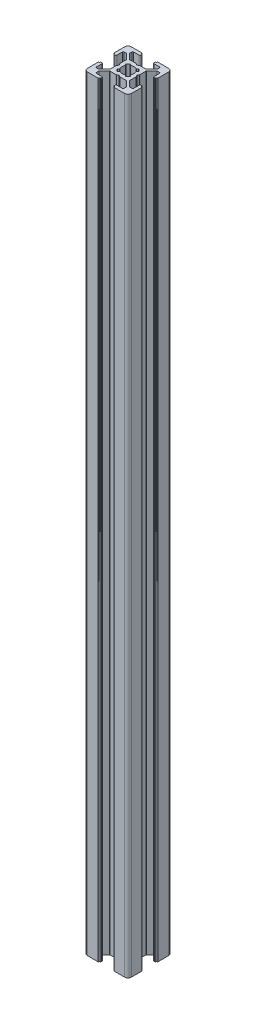
from build123d import *

# Parameters (mm, degrees)
BOSS_EXTRUDE1_DEPTH = 175


with BuildPart() as part:
    # Sketch2 → Boss-Extrude1 (new, symmetric)
    with BuildSketch(Plane(origin=(0, 0, 0), x_dir=(1, 0, 0), z_dir=(0, 1, 0))):
        with BuildLine():
            Line((-10, 3.75), (-10, 8.5))
            ThreePointArc((-10, 8.5), (-9.560660172, 9.560660172), (-8.5, 10))
            Line((-8.5, 10), (-3.75, 10))
            ThreePointArc((-3.75, 10), (-3.608578644, 9.941421356), (-3.55, 9.8))
            Line((-3.55, 9.8), (-3.55, 9.7))
            ThreePointArc((-3.55, 9.7), (-3.491421356, 9.558578644), (-3.35, 9.5))
            Line((-3.35, 9.5), (-3.2, 9.5))
            ThreePointArc((-3.2, 9.5), (-3.058578644, 9.441421356), (-3, 9.3))
            Line((-3, 9.3), (-3, 8.9))
            ThreePointArc((-3, 8.9), (-3.117157288, 8.617157288), (-3.4, 8.5))
            Line((-3.4, 8.5), (-5.9, 8.5))
            ThreePointArc((-5.9, 8.5), (-6.182842712, 8.382842712), (-6.3, 8.1))
            Line((-6.3, 8.1), (-6.3, 7.172792206))
            ThreePointArc((-6.3, 7.172792206), (-6.269551813, 7.019718833), (-6.182842712, 6.889949494))
            Line((-6.182842712, 6.889949494), (-3.910050506, 4.617157288))
            ThreePointArc((-3.910050506, 4.617157288), (-3.780281167, 4.530448187), (-3.627207794, 4.5))
            Line((-3.627207794, 4.5), (-0.919615242, 4.5))
            ThreePointArc((-0.919615242, 4.5), (-0.867851433, 4.493185165), (-0.819615242, 4.473205081))
            Line((-0.819615242, 4.473205081), (-0.1, 4.057735027))
            ThreePointArc((-0.1, 4.057735027), (0, 4.030940108), (0.1, 4.057735027))
            Line((0.1, 4.057735027), (0.819615242, 4.473205081))
            ThreePointArc((0.819615242, 4.473205081), (0.867851433, 4.493185165), (0.919615242, 4.5))
            Line((0.919615242, 4.5), (3.627207794, 4.5))
            ThreePointArc((3.627207794, 4.5), (3.780281167, 4.530448187), (3.910050506, 4.617157288))
            Line((3.910050506, 4.617157288), (6.182842712, 6.889949494))
            ThreePointArc((6.182842712, 6.889949494), (6.269551813, 7.019718833), (6.3, 7.172792206))
            Line((6.3, 7.172792206), (6.3, 8.1))
            ThreePointArc((6.3, 8.1), (6.182842712, 8.382842712), (5.9, 8.5))
            Line((5.9, 8.5), (3.4, 8.5))
            ThreePointArc((3.4, 8.5), (3.117157288, 8.617157288), (3, 8.9))
            Line((3, 8.9), (3, 9.3))
            ThreePointArc((3, 9.3), (3.058578644, 9.441421356), (3.2, 9.5))
            Line((3.2, 9.5), (3.35, 9.5))
            ThreePointArc((3.35, 9.5), (3.491421356, 9.558578644), (3.55, 9.7))
            Line((3.55, 9.7), (3.55, 9.8))
            ThreePointArc((3.55, 9.8), (3.608578644, 9.941421356), (3.75, 10))
            Line((3.75, 10), (8.5, 10))
            ThreePointArc((8.5, 10), (9.560660172, 9.560660172), (10, 8.5))
            Line((10, 8.5), (10, 3.75))
            ThreePointArc((10, 3.75), (9.941421356, 3.608578644), (9.8, 3.55))
            Line((9.8, 3.55), (9.7, 3.55))
            ThreePointArc((9.7, 3.55), (9.558578644, 3.491421356), (9.5, 3.35))
            Line((9.5, 3.35), (9.5, 3.2))
            ThreePointArc((9.5, 3.2), (9.441421356, 3.058578644), (9.3, 3))
            Line((9.3, 3), (8.9, 3))
            ThreePointArc((8.9, 3), (8.617157288, 3.117157288), (8.5, 3.4))
            Line((8.5, 3.4), (8.5, 5.9))
            ThreePointArc((8.5, 5.9), (8.382842712, 6.182842712), (8.1, 6.3))
            Line((8.1, 6.3), (7.172792206, 6.3))
            ThreePointArc((7.172792206, 6.3), (7.019718833, 6.269551813), (6.889949494, 6.182842712))
            Line((6.889949494, 6.182842712), (4.617157288, 3.910050506))
            ThreePointArc((4.617157288, 3.910050506), (4.530448187, 3.780281167), (4.5, 3.627207794))
            Line((4.5, 3.627207794), (4.5, 0.919615242))
            ThreePointArc((4.5, 0.919615242), (4.493185165, 0.867851433), (4.473205081, 0.819615242))
            Line((4.473205081, 0.819615242), (4.057735027, 0.1))
            ThreePointArc((4.057735027, 0.1), (4.030940108, 0), (4.057735027, -0.1))
            Line((4.057735027, -0.1), (4.473205081, -0.819615242))
            ThreePointArc((4.473205081, -0.819615242), (4.493185165, -0.867851433), (4.5, -0.919615242))
            Line((4.5, -0.919615242), (4.5, -3.627207794))
            ThreePointArc((4.5, -3.627207794), (4.530448187, -3.780281167), (4.617157288, -3.910050506))
            Line((4.617157288, -3.910050506), (6.889949494, -6.182842712))
            ThreePointArc((6.889949494, -6.182842712), (7.019718833, -6.269551813), (7.172792206, -6.3))
            Line((7.172792206, -6.3), (8.1, -6.3))
            ThreePointArc((8.1, -6.3), (8.382842712, -6.182842712), (8.5, -5.9))
            Line((8.5, -5.9), (8.5, -3.4))
            ThreePointArc((8.5, -3.4), (8.617157288, -3.117157288), (8.9, -3))
            Line((8.9, -3), (9.3, -3))
            ThreePointArc((9.3, -3), (9.441421356, -3.058578644), (9.5, -3.2))
            Line((9.5, -3.2), (9.5, -3.35))
            ThreePointArc((9.5, -3.35), (9.558578644, -3.491421356), (9.7, -3.55))
            Line((9.7, -3.55), (9.8, -3.55))
            ThreePointArc((9.8, -3.55), (9.941421356, -3.608578644), (10, -3.75))
            Line((10, -3.75), (10, -8.5))
            ThreePointArc((10, -8.5), (9.560660172, -9.560660172), (8.5, -10))
            Line((8.5, -10), (3.75, -10))
            ThreePointArc((3.75, -10), (3.608578644, -9.941421356), (3.55, -9.8))
            Line((3.55, -9.8), (3.55, -9.7))
            ThreePointArc((3.55, -9.7), (3.491421356, -9.558578644), (3.35, -9.5))
            Line((3.35, -9.5), (3.2, -9.5))
            ThreePointArc((3.2, -9.5), (3.058578644, -9.441421356), (3, -9.3))
            Line((3, -9.3), (3, -8.9))
            ThreePointArc((3, -8.9), (3.117157288, -8.617157288), (3.4, -8.5))
            Line((3.4, -8.5), (5.9, -8.5))
            ThreePointArc((5.9, -8.5), (6.182842712, -8.382842712), (6.3, -8.1))
            Line((6.3, -8.1), (6.3, -7.172792206))
            ThreePointArc((6.3, -7.172792206), (6.269551813, -7.019718833), (6.182842712, -6.889949494))
            Line((6.182842712, -6.889949494), (3.910050506, -4.617157288))
            ThreePointArc((3.910050506, -4.617157288), (3.780281167, -4.530448187), (3.627207794, -4.5))
            Line((3.627207794, -4.5), (0.919615242, -4.5))
            ThreePointArc((0.919615242, -4.5), (0.867851433, -4.493185165), (0.819615242, -4.473205081))
            Line((0.819615242, -4.473205081), (0.1, -4.057735027))
            ThreePointArc((0.1, -4.057735027), (0, -4.030940108), (-0.1, -4.057735027))
            Line((-0.1, -4.057735027), (-0.819615242, -4.473205081))
            ThreePointArc((-0.819615242, -4.473205081), (-0.867851433, -4.493185165), (-0.919615242, -4.5))
            Line((-0.919615242, -4.5), (-3.627207794, -4.5))
            ThreePointArc((-3.627207794, -4.5), (-3.780281167, -4.530448187), (-3.910050506, -4.617157288))
            Line((-3.910050506, -4.617157288), (-6.182842712, -6.889949494))
            ThreePointArc((-6.182842712, -6.889949494), (-6.269551813, -7.019718833), (-6.3, -7.172792206))
            Line((-6.3, -7.172792206), (-6.3, -8.1))
            ThreePointArc((-6.3, -8.1), (-6.182842712, -8.382842712), (-5.9, -8.5))
            Line((-5.9, -8.5), (-3.4, -8.5))
            ThreePointArc((-3.4, -8.5), (-3.117157288, -8.617157288), (-3, -8.9))
            Line((-3, -8.9), (-3, -9.3))
            ThreePointArc((-3, -9.3), (-3.058578644, -9.441421356), (-3.2, -9.5))
            Line((-3.2, -9.5), (-3.35, -9.5))
            ThreePointArc((-3.35, -9.5), (-3.491421356, -9.558578644), (-3.55, -9.7))
            Line((-3.55, -9.7), (-3.55, -9.8))
            ThreePointArc((-3.55, -9.8), (-3.608578644, -9.941421356), (-3.75, -10))
            Line((-3.75, -10), (-8.5, -10))
            ThreePointArc((-8.5, -10), (-9.560660172, -9.560660172), (-10, -8.5))
            Line((-10, -8.5), (-10, -3.75))
            ThreePointArc((-10, -3.75), (-9.941421356, -3.608578644), (-9.8, -3.55))
            Line((-9.8, -3.55), (-9.7, -3.55))
            ThreePointArc((-9.7, -3.55), (-9.558578644, -3.491421356), (-9.5, -3.35))
            Line((-9.5, -3.35), (-9.5, -3.2))
            ThreePointArc((-9.5, -3.2), (-9.441421356, -3.058578644), (-9.3, -3))
            Line((-9.3, -3), (-8.9, -3))
            ThreePointArc((-8.9, -3), (-8.617157288, -3.117157288), (-8.5, -3.4))
            Line((-8.5, -3.4), (-8.5, -5.9))
            ThreePointArc((-8.5, -5.9), (-8.382842712, -6.182842712), (-8.1, -6.3))
            Line((-8.1, -6.3), (-7.172792206, -6.3))
            ThreePointArc((-7.172792206, -6.3), (-7.019718833, -6.269551813), (-6.889949494, -6.182842712))
            Line((-6.889949494, -6.182842712), (-4.617157288, -3.910050506))
            ThreePointArc((-4.617157288, -3.910050506), (-4.530448187, -3.780281167), (-4.5, -3.627207794))
            Line((-4.5, -3.627207794), (-4.5, -0.919615242))
            ThreePointArc((-4.5, -0.919615242), (-4.493185165, -0.867851433), (-4.473205081, -0.819615242))
            Line((-4.473205081, -0.819615242), (-4.057735027, -0.1))
            ThreePointArc((-4.057735027, -0.1), (-4.030940108, 0), (-4.057735027, 0.1))
            Line((-4.057735027, 0.1), (-4.473205081, 0.819615242))
            ThreePointArc((-4.473205081, 0.819615242), (-4.493185165, 0.867851433), (-4.5, 0.919615242))
            Line((-4.5, 0.919615242), (-4.5, 3.627207794))
            ThreePointArc((-4.5, 3.627207794), (-4.530448187, 3.780281167), (-4.617157288, 3.910050506))
            Line((-4.617157288, 3.910050506), (-6.889949494, 6.182842712))
            ThreePointArc((-6.889949494, 6.182842712), (-7.019718833, 6.269551813), (-7.172792206, 6.3))
            Line((-7.172792206, 6.3), (-8.1, 6.3))
            ThreePointArc((-8.1, 6.3), (-8.382842712, 6.182842712), (-8.5, 5.9))
            Line((-8.5, 5.9), (-8.5, 3.4))
            ThreePointArc((-8.5, 3.4), (-8.617157288, 3.117157288), (-8.9, 3))
            Line((-8.9, 3), (-9.3, 3))
            ThreePointArc((-9.3, 3), (-9.441421356, 3.058578644), (-9.5, 3.2))
            Line((-9.5, 3.2), (-9.5, 3.35))
            ThreePointArc((-9.5, 3.35), (-9.558578644, 3.491421356), (-9.7, 3.55))
            Line((-9.7, 3.55), (-9.8, 3.55))
            ThreePointArc((-9.8, 3.55), (-9.941421356, 3.608578644), (-10, 3.75))
        make_face()
        with BuildLine():
            Line((-2.479688955, 1.419028783), (-2.896761999, 1.836101827))
            ThreePointArc((-2.896761999, 1.836101827), (-2.940106295, 1.928880314), (-2.913814922, 2.02785172))
            ThreePointArc((-2.913814922, 2.02785172), (-2.510229073, 2.510229073), (-2.02785172, 2.913814922))
            ThreePointArc((-2.02785172, 2.913814922), (-1.928880314, 2.940106295), (-1.836101827, 2.896761999))
            Line((-1.836101827, 2.896761999), (-1.419028783, 2.479688955))
            ThreePointArc((-1.419028783, 2.479688955), (-1.336531377, 2.437618141), (-1.245050899, 2.452009025))
            ThreePointArc((-1.245050899, 2.452009025), (0, 2.75), (1.245050899, 2.452009025))
            ThreePointArc((1.245050899, 2.452009025), (1.336531377, 2.437618141), (1.419028783, 2.479688955))
            Line((1.419028783, 2.479688955), (1.836101827, 2.896761999))
            ThreePointArc((1.836101827, 2.896761999), (1.928880314, 2.940106295), (2.02785172, 2.913814922))
            ThreePointArc((2.02785172, 2.913814922), (2.510229073, 2.510229073), (2.913814922, 2.02785172))
            ThreePointArc((2.913814922, 2.02785172), (2.940106295, 1.928880314), (2.896761999, 1.836101827))
            Line((2.896761999, 1.836101827), (2.479688955, 1.419028783))
            ThreePointArc((2.479688955, 1.419028783), (2.437618141, 1.336531377), (2.452009025, 1.245050899))
            ThreePointArc((2.452009025, 1.245050899), (2.75, 0), (2.452009025, -1.245050899))
            ThreePointArc((2.452009025, -1.245050899), (2.437618141, -1.336531377), (2.479688955, -1.419028783))
            Line((2.479688955, -1.419028783), (2.896761999, -1.836101827))
            ThreePointArc((2.896761999, -1.836101827), (2.940106295, -1.928880314), (2.913814922, -2.02785172))
            ThreePointArc((2.913814922, -2.02785172), (2.510229073, -2.510229073), (2.02785172, -2.913814922))
            ThreePointArc((2.02785172, -2.913814922), (1.928880314, -2.940106295), (1.836101827, -2.896761999))
            Line((1.836101827, -2.896761999), (1.419028783, -2.479688955))
            ThreePointArc((1.419028783, -2.479688955), (1.336531377, -2.437618141), (1.245050899, -2.452009025))
            ThreePointArc((1.245050899, -2.452009025), (0, -2.75), (-1.245050899, -2.452009025))
            ThreePointArc((-1.245050899, -2.452009025), (-1.336531377, -2.437618141), (-1.419028783, -2.479688955))
            Line((-1.419028783, -2.479688955), (-1.836101827, -2.896761999))
            ThreePointArc((-1.836101827, -2.896761999), (-1.928880314, -2.940106295), (-2.02785172, -2.913814922))
            ThreePointArc((-2.02785172, -2.913814922), (-2.510229073, -2.510229073), (-2.913814922, -2.02785172))
            ThreePointArc((-2.913814922, -2.02785172), (-2.940106295, -1.928880314), (-2.896761999, -1.836101827))
            Line((-2.896761999, -1.836101827), (-2.479688955, -1.419028783))
            ThreePointArc((-2.479688955, -1.419028783), (-2.437618141, -1.336531377), (-2.452009025, -1.245050899))
            ThreePointArc((-2.452009025, -1.245050899), (-2.75, 0), (-2.452009025, 1.245050899))
            ThreePointArc((-2.452009025, 1.245050899), (-2.437618141, 1.336531377), (-2.479688955, 1.419028783))
        make_face(mode=Mode.SUBTRACT)
    extrude(amount=BOSS_EXTRUDE1_DEPTH, both=True)


solid = part.part
